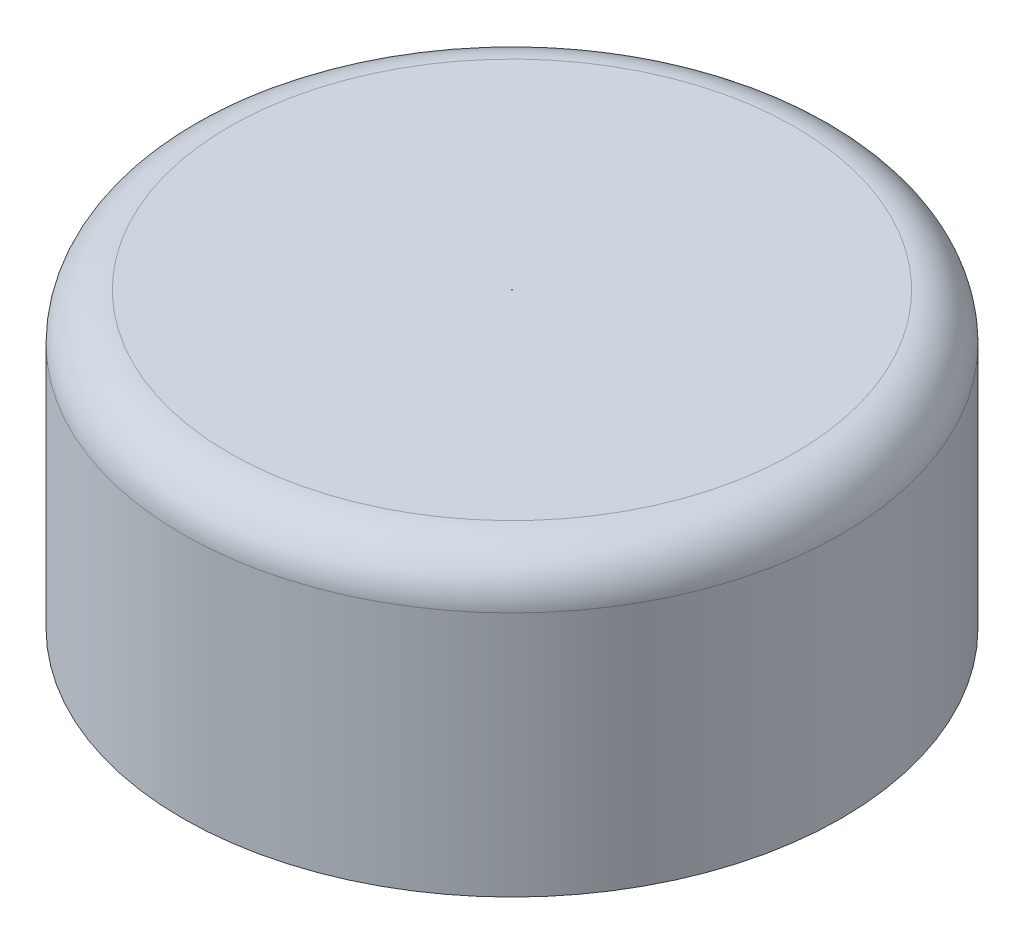
from build123d import *

# Parameters (mm, degrees)
SKETCH1_R           = 14.2875
BOSS_EXTRUDE1_DEPTH = 12.7
FILLET1_R           = 2.032
SHELL1_T            = -2.54
CUT_EXTRUDE1_REACH  = 25.865
SKETCH2_R           = 0.0127


with BuildPart() as part:
    # Sketch1 → Boss-Extrude1 (new body)
    with BuildSketch(Plane(origin=(0, 0, 0), x_dir=(1, 0, 0), z_dir=(0, 1, 0))):
        with Locations(Location((0, 0, 0), (0, 0, 270))):
            Circle(SKETCH1_R)
    extrude(amount=BOSS_EXTRUDE1_DEPTH)

    # Fillet1
    fillet1_edges = [part.edges().sort_by_distance(p)[0] for p in [
        (0, 12.7, -14.2875),
    ]]
    fillet(fillet1_edges, radius=FILLET1_R)

    # Shell1
    shell1_openings = [part.faces().sort_by_distance(p)[0] for p in [
        (0, 0, 0),
    ]]
    offset(amount=SHELL1_T, openings=shell1_openings, kind=Kind.INTERSECTION)

    # Sketch2 → Cut-Extrude1 (cut, up to next)
    with BuildSketch(Plane(origin=(0, 12.7, 0), x_dir=(1, 0, 0), z_dir=(0, 1, 0)), mode=Mode.PRIVATE) as cut_extrude1_sk1:
        with Locations(Location((0, 0, 0), (0, 0, 270))):
            Circle(SKETCH2_R)
    cut_extrude1_tool1 = extrude(cut_extrude1_sk1.sketch, amount=-CUT_EXTRUDE1_REACH, mode=Mode.PRIVATE) & part.part
    add(cut_extrude1_tool1.solids().sort_by_distance((0, 12.7, 0))[0], mode=Mode.SUBTRACT)


solid = part.part
